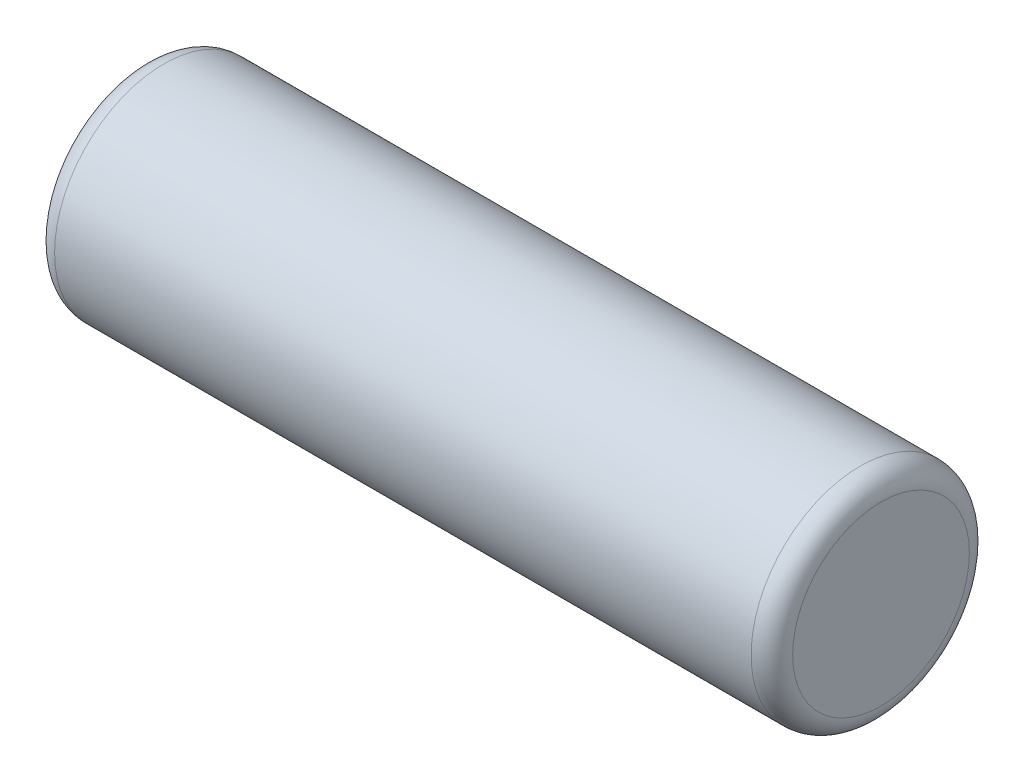
from build123d import *

# Parameters (mm, degrees)
SKETCH_1_W      = 71
SKETCH_1_H      = 10.5
FILLET_1_R      = 2
FILLET_2_R      = 2
SKETCH_2_R      = 2.5
EXTRUDE_1_DEPTH = 2
FILLET_3_R      = 1


with BuildPart() as part:
    # 草图1 → 旋转3 (revolve)
    with BuildSketch(Plane(origin=(0, 0, 0), x_dir=(1, 0, 0), z_dir=(0, 1, 0))):
        with Locations((0, 5.25)):
            Rectangle(SKETCH_1_W, SKETCH_1_H)
    revolve(axis=Axis((35.5, 0, 0), (-1, 0, 0)))

    # 圆角1
    fillet_1_edges = [part.edges().sort_by_distance(p)[0] for p in [
        (-35.5, 0, 10.5),
    ]]
    fillet(fillet_1_edges, radius=FILLET_1_R)

    # 圆角2
    fillet_2_edges = [part.edges().sort_by_distance(p)[0] for p in [
        (35.5, 0, 10.5),
    ]]
    fillet(fillet_2_edges, radius=FILLET_2_R)

    # 草图2 → 凸台-拉伸1 (add)
    with BuildSketch(Plane.ZY.offset(35.5)):
        Circle(SKETCH_2_R)
    extrude(amount=EXTRUDE_1_DEPTH)

    # 圆角3
    fillet_3_edges = [part.edges().sort_by_distance(p)[0] for p in [
        (-37.5, 0, -2.5),
    ]]
    fillet(fillet_3_edges, radius=FILLET_3_R)


solid = part.part
